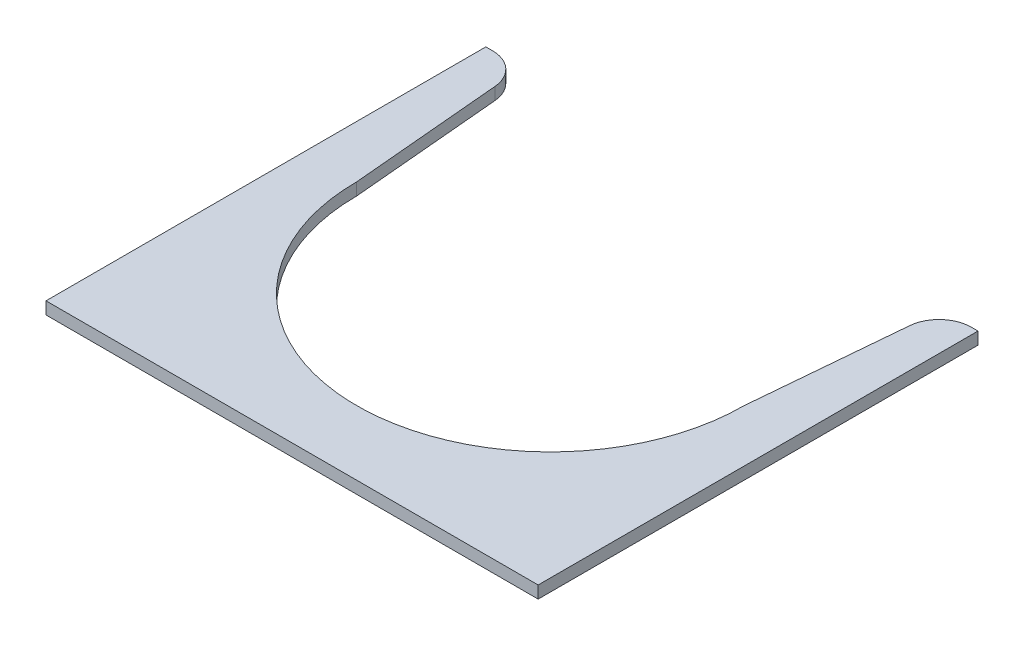
from build123d import *

# Parameters (mm, degrees)
SKETCH1_W             = 193.548
SKETCH1_H             = 172.974
BASE_DEPTH            = 4.826
CENTER_CUT_DEPTH      = 260.623040688
LEADING_EDGE_FILLET_R = 12.7


with BuildPart() as part:
    # Sketch1 → Base (new body)
    with BuildSketch(Plane(origin=(0, 0, 0), x_dir=(1, 0, 0), z_dir=(0, 1, 0))):
        with Locations((96.774, 86.487)):
            Rectangle(SKETCH1_W, SKETCH1_H)
    extrude(amount=BASE_DEPTH)

    # Sketch2 → Center Cut (cut, through all)
    with BuildSketch(Plane(origin=(0, 4.826, 0), x_dir=(1, 0, 0), z_dir=(0, 1, 0))):
        with BuildLine():
            Line((20.574, 101.6), (14.224, 172.974))
            Line((14.224, 172.974), (179.324, 172.974))
            Line((179.324, 172.974), (172.974, 101.6))
            ThreePointArc((172.974, 101.6), (96.774, 25.4), (20.574, 101.6))
        make_face()
    extrude(amount=-CENTER_CUT_DEPTH, mode=Mode.SUBTRACT)

    # Leading Edge Fillet
    leading_edge_fillet_edges = [part.edges().sort_by_distance(p)[0] for p in [
        (14.224, 2.413, -172.974),
        (179.324, 2.413, -172.974),
    ]]
    fillet(leading_edge_fillet_edges, radius=LEADING_EDGE_FILLET_R)


solid = part.part
